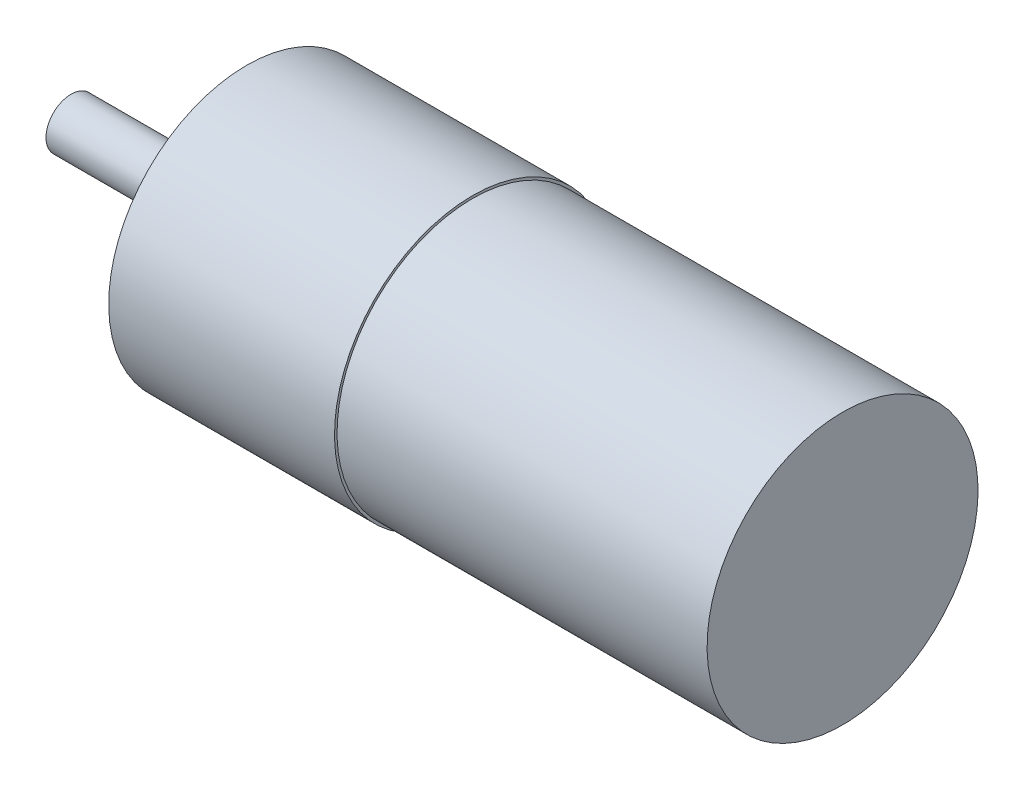
from build123d import *

# Parameters (mm, degrees)
SKETCH2_W                 = 29.5
SKETCH2_H                 = 10.8
SKETCH2_W_2               = 12
SKETCH2_H_2               = 2
F_2_0MM_DOWEL_HOLE1_D     = 2
F_2_0MM_DOWEL_HOLE1_DEPTH = 0.4
F_2_0MM_DOWEL_HOLE1_TIP   = 0.600860619


with BuildPart() as part:
    # Sketch2 → Revolve1 (revolve)
    with BuildSketch(Plane.XY, mode=Mode.PRIVATE) as revolve1_sk:
        Polygon((0, -10.8), (0, 0), (-18, 0), (-18, -7), (-18, -11), (0, -11), align=None)
        with Locations((14.75, -5.4)):
            Rectangle(SKETCH2_W, SKETCH2_H)
        Polygon((-18, -7), (-18, 0), (-20, 0), (-20, -2), (-20, -7), align=None)
        with Locations((-26, -1)):
            Rectangle(SKETCH2_W_2, SKETCH2_H_2)
    revolve(revolve1_sk.sketch.rotate(Axis((0, 0, 0), (-1, 0, 0)), 180), axis=Axis((0, 0, 0), (-1, 0, 0)))

    # Ø2.0mm Dowel Hole1
    with Locations(Plane.ZY.offset(18)):
        with Locations((-9, 0), (0, 9), (9, 0), (0, -9)):
            Hole(F_2_0MM_DOWEL_HOLE1_D / 2, depth=F_2_0MM_DOWEL_HOLE1_DEPTH)
            with Locations((0, 0, -(F_2_0MM_DOWEL_HOLE1_DEPTH + F_2_0MM_DOWEL_HOLE1_TIP / 2))):  # 118° drill point
                Cone(0, F_2_0MM_DOWEL_HOLE1_D / 2, F_2_0MM_DOWEL_HOLE1_TIP, mode=Mode.SUBTRACT)


solid = part.part
